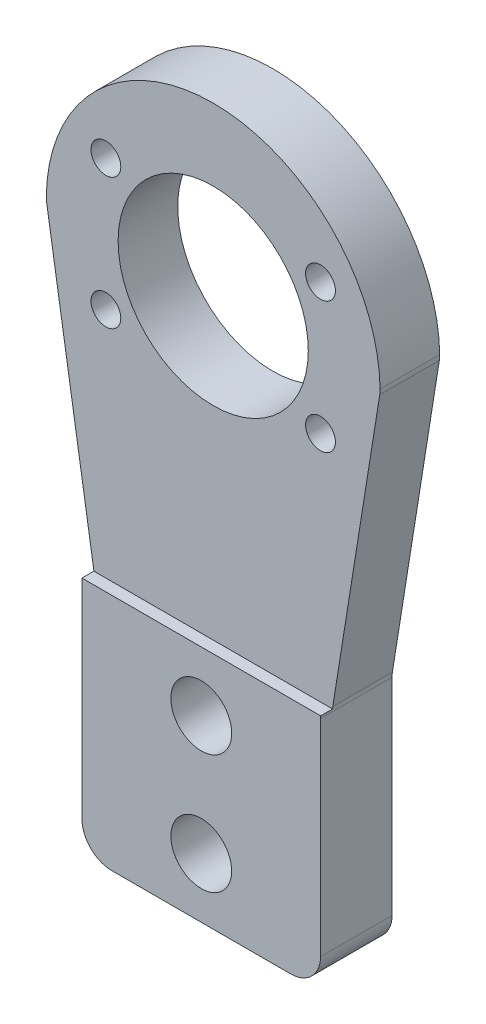
from build123d import *

# Parameters (mm, degrees)
SKETCH1_R           = 2.55
BOSS_EXTRUDE2_DEPTH = 6
FILLET1_R           = 2.5
SKETCH3_R           = 7.975
CUT_EXTRUDE2_DEPTH  = 47.561319795
SKETCH2_R           = 1.25
CUT_EXTRUDE1_DEPTH  = 47.561319795
SKETCH6_W           = 40
SKETCH6_H           = 50
CUT_EXTRUDE5_DEPTH  = 1


with BuildPart() as part:
    # Sketch1 → Boss-Extrude2 (new body)
    with BuildSketch(Plane.XY):
        with BuildLine():
            Line((-10, -15), (-10, 5))
            Line((-10, 5), (-14, 30))
            ThreePointArc((-14, 30), (0, 44), (14, 30))
            Line((14, 30), (10, 5))
            Line((10, 5), (10, -15))
            Line((10, -15), (-10, -15))
        make_face()
        Circle(SKETCH1_R, mode=Mode.SUBTRACT)
        with Locations((0, -10)):
            Circle(SKETCH1_R, mode=Mode.SUBTRACT)
    extrude(amount=BOSS_EXTRUDE2_DEPTH)

    # Fillet1
    fillet1_edges = [part.edges().sort_by_distance(p)[0] for p in [
        (-14, 30, 3),
        (14, 30, 3),
        (10, 5, 3),
        (10, -15, 3),
        (-10, -15, 3),
        (-10, 5, 3),
    ]]
    fillet(fillet1_edges, radius=FILLET1_R)

    # Sketch3 → Cut-Extrude2 (cut, through all)
    with BuildSketch(Plane.XY.offset(6)):
        with Locations((0, 30)):
            Circle(SKETCH3_R)
    extrude(amount=-CUT_EXTRUDE2_DEPTH, mode=Mode.SUBTRACT)

    # Sketch2 → Cut-Extrude1 (cut, through all)
    with BuildSketch(Plane.XY.offset(6)):
        with Locations((-9, 24.5)):
            Circle(SKETCH2_R)
        with Locations((9, 24.5)):
            Circle(SKETCH2_R)
        with Locations((-9, 35.5)):
            Circle(SKETCH2_R)
        with Locations((9, 35.5)):
            Circle(SKETCH2_R)
    extrude(amount=-CUT_EXTRUDE1_DEPTH, mode=Mode.SUBTRACT)

    # Sketch6 → Cut-Extrude5 (cut)
    with BuildSketch(Plane.XY.offset(6)):
        with Locations((0, 30)):
            Rectangle(SKETCH6_W, SKETCH6_H)
    extrude(amount=-CUT_EXTRUDE5_DEPTH, mode=Mode.SUBTRACT)


solid = part.part
